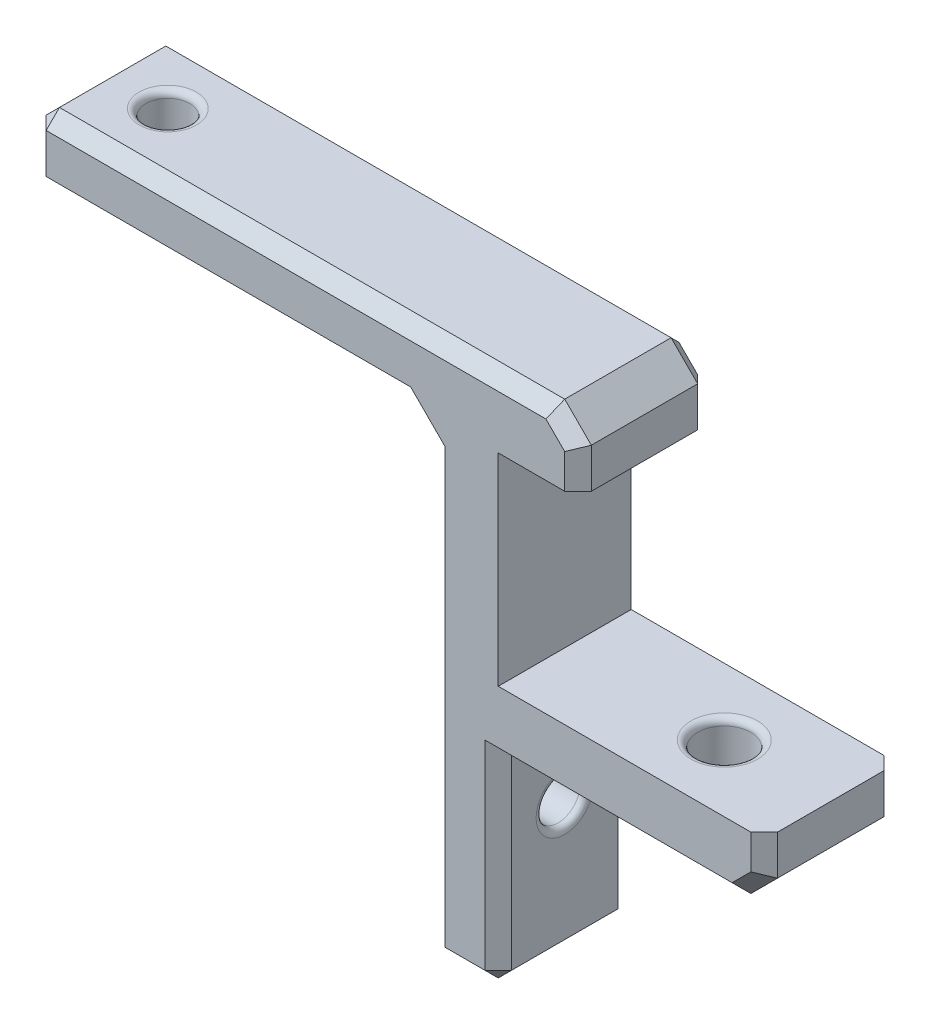
from build123d import *

# Parameters (mm, degrees)
RESSALTO_EXTRUS_O1_DEPTH = 10
ESBO_O3_R                = 2
CORTE_EXTRUS_O1_DEPTH    = 15
CHANFRO1_SIZE            = 1.6
FILETE1_R                = 0.5
CHANFRO5_SIZE            = 2
CHANFRO8_SIZE            = 1
ESBO_O4_R                = 1.65
CORTE_EXTRUS_O2_DEPTH    = 10
FILETE2_R                = 0.5
ESBO_O5_R                = 1.65
CORTE_EXTRUS_O3_DEPTH    = 10
FILETE3_R                = 0.5


with BuildPart() as part:
    # Esboço1 → Ressalto-extrusão1 (new body)
    with BuildSketch(Plane.XY):
        Polygon((-0.113617837, 14.25), (-6.113617837, 14.25), (-6.113617837, -0.95), (13.886382163, -0.95), (13.886382163, -5.95), (-6.113617837, -5.95), (-6.113617837, -20.95), (-11.113617837, -20.95), (-11.113617837, 14.25), (-41.113617837, 14.25), (-41.113617837, 19.25), (-0.113617837, 19.25), align=None)
    extrude(amount=RESSALTO_EXTRUS_O1_DEPTH)

    # Esboço3 → Corte-extrusão1 (cut)
    with BuildSketch(Plane.XZ.offset(5.95)):
        with Locations(Location((5.886382163, 5, 0), (0, 0, 270))):
            Circle(ESBO_O3_R)
    extrude(amount=-CORTE_EXTRUS_O1_DEPTH, mode=Mode.SUBTRACT)

    # Chanfro1
    chanfro1_edges = [part.edges().sort_by_distance(p)[0] for p in [
        (5.886382163, -5.95, 7),
    ]]
    chamfer(chanfro1_edges, length=CHANFRO1_SIZE)

    # Filete1
    filete1_edges = [part.edges().sort_by_distance(p)[0] for p in [
        (5.886382163, -0.95, 7),
    ]]
    fillet(filete1_edges, radius=FILETE1_R)

    # Chanfro5
    chanfro5_edges = [part.edges().sort_by_distance(p)[0] for p in [
        (13.886382163, -5.95, 5),
        (-11.113617837, 14.25, 5),
        (-0.113617837, 19.25, 5),
    ]]
    chamfer(chanfro5_edges, length=CHANFRO5_SIZE)

    # Chanfro8
    chanfro8_edges = [part.edges().sort_by_distance(p)[0] for p in [
        (-41.113617837, 19.25, 5),
        (-41.113617837, 16.75, 10),
        (-41.113617837, 14.25, 5),
        (-41.113617837, 16.75, 0),
        (-0.113617837, 15.75, 0),
        (-21.613617837, 19.25, 0),
        (13.886382163, -2.45, 0),
        (12.886382163, -4.95, 0),
        (2.886382163, -5.95, 0),
        (-11.113617837, -4.35, 0),
        (-12.113617837, 13.25, 0),
        (-27.113617837, 14.25, 0),
        (13.886382163, -2.45, 10),
        (12.886382163, -4.95, 10),
        (2.886382163, -5.95, 10),
        (-11.113617837, -4.35, 10),
        (-12.113617837, 13.25, 10),
        (-27.113617837, 14.25, 10),
        (-0.113617837, 15.75, 10),
        (-21.613617837, 19.25, 10),
        (-1.113617837, 18.25, 0),
        (-1.113617837, 18.25, 10),
        (-11.113617837, -20.95, 5),
        (-8.613617837, -20.95, 10),
        (-6.113617837, -13.45, 10),
        (-6.113617837, -20.95, 5),
        (-6.113617837, -13.45, 0),
        (-8.613617837, -20.95, 0),
    ]]
    chamfer(chanfro8_edges, length=CHANFRO8_SIZE)

    # Esboço4 → Corte-extrusão2 (cut)
    with BuildSketch(Plane(origin=(0, 19.25, 0), x_dir=(1, 0, 0), z_dir=(0, 1, 0))):
        with Locations(Location((-35.963617837, -5, 0), (0, 0, 270))):
            Circle(ESBO_O4_R)
    extrude(amount=-CORTE_EXTRUS_O2_DEPTH, mode=Mode.SUBTRACT)

    # Filete2
    filete2_edges = [part.edges().sort_by_distance(p)[0] for p in [
        (-35.963617837, 14.25, 3.35),
        (-35.963617837, 19.25, 3.35),
    ]]
    fillet(filete2_edges, radius=FILETE2_R)

    # Esboço5 → Corte-extrusão3 (cut)
    with BuildSketch(Plane.ZY.offset(11.113617837)):
        with Locations((5, -10.95)):
            Circle(ESBO_O5_R)
    extrude(amount=-CORTE_EXTRUS_O3_DEPTH, mode=Mode.SUBTRACT)

    # Filete3
    filete3_edges = [part.edges().sort_by_distance(p)[0] for p in [
        (-6.113617837, -10.95, 3.35),
        (-11.113617837, -10.95, 3.35),
    ]]
    fillet(filete3_edges, radius=FILETE3_R)


solid = part.part
